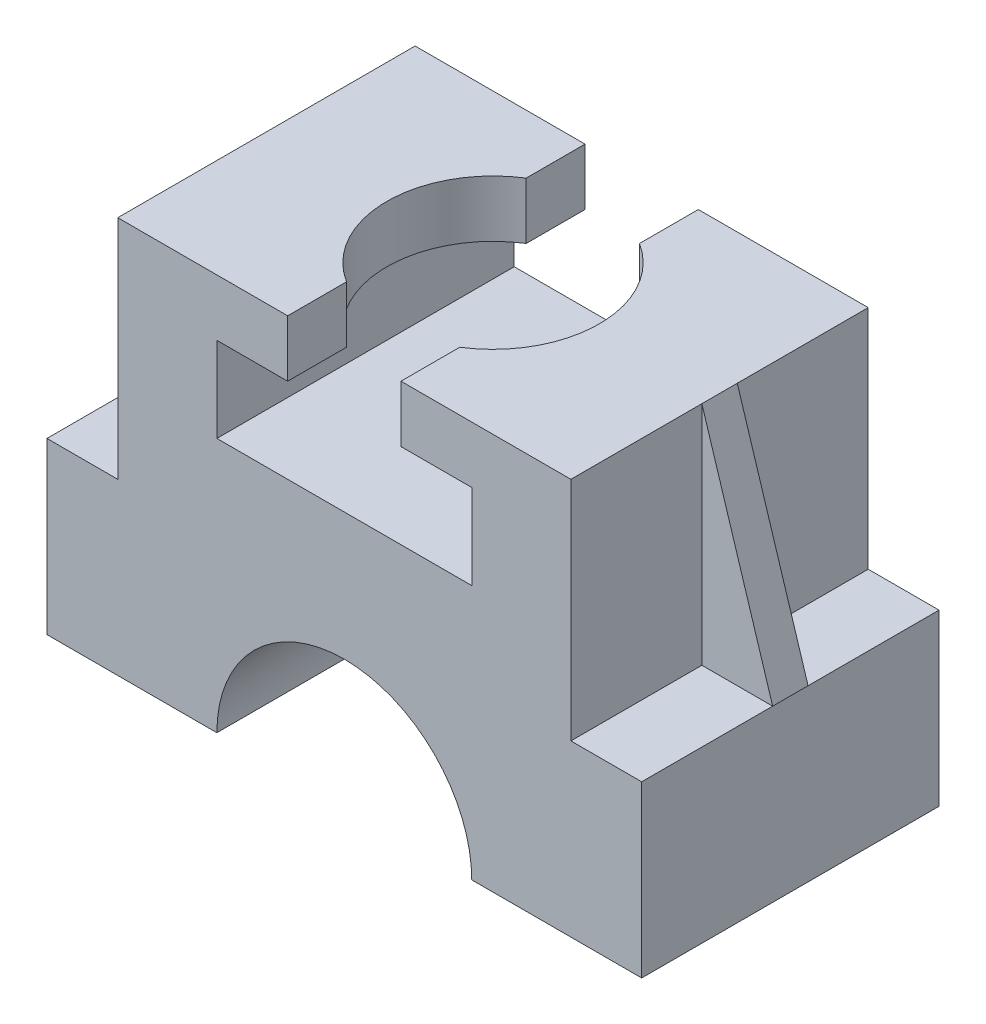
from build123d import *

# Parameters (mm, degrees)
BOSS_EXTRUDE1_DEPTH      = 52.5
BOSS_EXTRUDE1_DEPTH_BACK = 52.5
CUT_EXTRUDE1_DEPTH       = 205.08331632
SKETCH3_W                = 90
SKETCH3_H                = 30
CUT_EXTRUDE2_DEPTH       = 205.08331632
CUT_EXTRUDE3_REACH       = 184.705
BOSS_EXTRUDE2_DEPTH      = 6.25


with BuildPart() as part:
    # Sketch1 → Boss-Extrude1 (new, two sides: drawn at the far end of the back side and taken through both)
    with BuildSketch(Plane.XY.offset(-BOSS_EXTRUDE1_DEPTH_BACK)):
        Polygon((-105, 0), (105, 0), (105, 60), (80, 60), (80, 140), (-80, 140), (-80, 60), (-105, 60), align=None)
    extrude(amount=BOSS_EXTRUDE1_DEPTH + BOSS_EXTRUDE1_DEPTH_BACK)

    # Sketch2 → Cut-Extrude1 (cut, through all)
    with BuildSketch(Plane.XY.offset(52.5)):
        with BuildLine():
            Line((-45, 0), (45, 0))
            ThreePointArc((45, 0), (0, 45), (-45, 0))
        make_face()
    extrude(amount=-CUT_EXTRUDE1_DEPTH, mode=Mode.SUBTRACT)

    # Sketch3 → Cut-Extrude2 (cut, through all)
    with BuildSketch(Plane.XY.offset(52.5)):
        with Locations((0, 105)):
            Rectangle(SKETCH3_W, SKETCH3_H)
    extrude(amount=-CUT_EXTRUDE2_DEPTH, mode=Mode.SUBTRACT)

    # Sketch5 → Cut-Extrude3 (cut, up to next)
    with BuildSketch(Plane(origin=(0, 140, 0), x_dir=(1, 0, 0), z_dir=(0, 1, 0)), mode=Mode.PRIVATE) as cut_extrude3_sk1:
        with BuildLine():
            Line((-20, 52.5), (-20, 31.721443851))
            ThreePointArc((-20, 31.721443851), (-37.5, 0), (-20, -31.721443851))
            Line((-20, -31.721443851), (-20, -52.5))
            Line((-20, -52.5), (20, -52.5))
            Line((20, -52.5), (20, -31.721443851))
            ThreePointArc((20, -31.721443851), (37.5, 0), (20, 31.721443851))
            Line((20, 31.721443851), (20, 52.5))
            Line((20, 52.5), (-20, 52.5))
        make_face()
    cut_extrude3_tool1 = extrude(cut_extrude3_sk1.sketch, amount=-CUT_EXTRUDE3_REACH, mode=Mode.PRIVATE) & part.part
    add(cut_extrude3_tool1.solids().sort_by_distance((0, 140, 0))[0], mode=Mode.SUBTRACT)

    # Sketch6 → Boss-Extrude2 (add, symmetric)
    with BuildSketch(Plane.XY):
        Polygon((80, 140), (105, 60), (80, 60), align=None)
    boss_extrude2 = extrude(amount=BOSS_EXTRUDE2_DEPTH, both=True)

    # Mirror1: Boss-Extrude2 across plane
    add(boss_extrude2.mirror(Plane(origin=(0, 0, 0), x_dir=(0, 0, 1), z_dir=(1, 0, 0))))


solid = part.part
